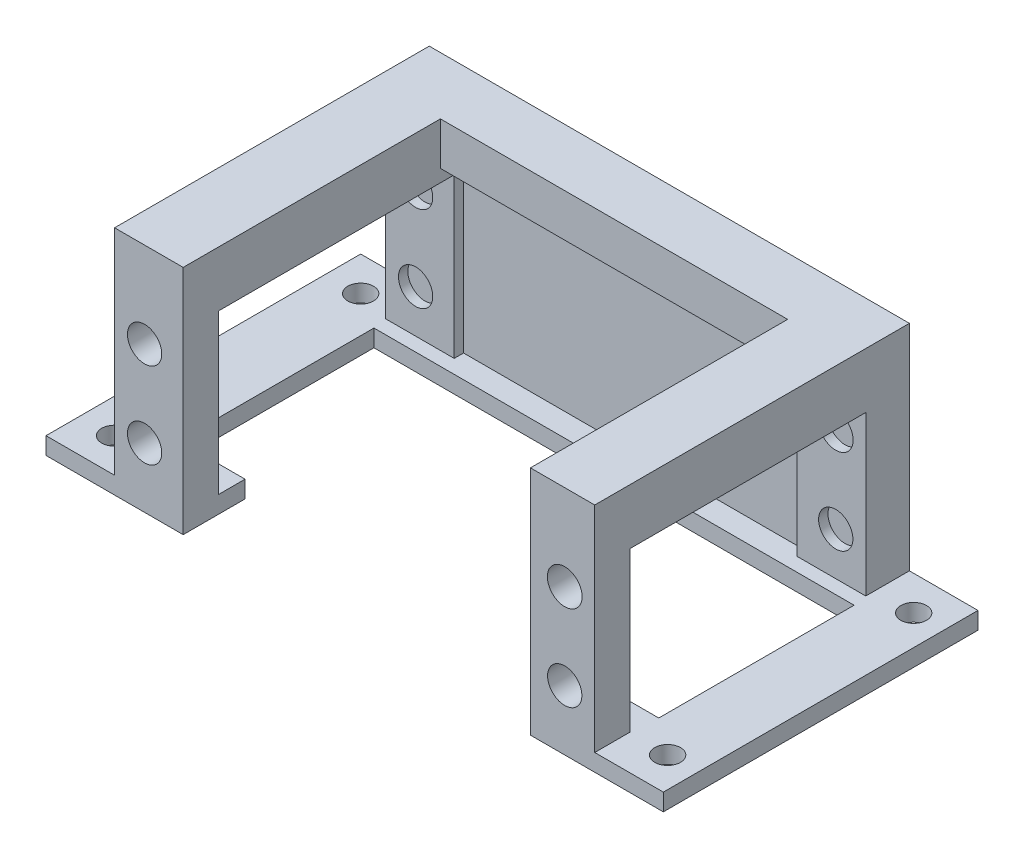
from build123d import *

# Parameters (mm, degrees)
SKETCH_1_W               = 40
SKETCH_1_H               = 40
EXTRUDE_1_DEPTH          = 20
SKETCH_2_R               = 3
EXTRUDE_2_DEPTH          = 4.5
SKETCH_4_R               = 2
SKETCH_4_W               = 8
SKETCH_4_H               = 20
EXTRUDE_4_DEPTH          = 2.7
SKETCH_5_W               = 4
SKETCH_5_H               = 7
EXTRUDE_5_DEPTH          = 7
SKETCH_6_W               = 48
SKETCH_6_H               = 20
CUT_EXTRUDE_1_DEPTH      = 27.5
CUT_EXTRUDE_3_DEPTH      = 54.481305145
CUT_EXTRUDE_3_DEPTH_BACK = 54.481305145
SKETCH_7_W               = 40
SKETCH_7_H               = 20
SKETCH_8_W               = 56
SKETCH_8_H               = 5
EXTRUDE_6_DEPTH          = 2.7
SKETCH_9_W               = 56
SKETCH_9_H               = 25
EXTRUDE_7_DEPTH          = 30
CUT_EXTRUDE_4_DEPTH      = 62.878914018
CUT_EXTRUDE_4_DEPTH_BACK = 62.878914018
SKETCH_10_W              = 40
SKETCH_10_H              = 20
CUT_EXTRUDE_5_DEPTH      = 64.232033021
CUT_EXTRUDE_5_DEPTH_BACK = 64.232033021
SKETCH_11_R              = 2
SKETCH_11_R_2            = 2.023853946
CUT_EXTRUDE_6_DEPTH      = 75.500268456
CUT_EXTRUDE_6_DEPTH_BACK = 75.500268456
SKETCH_12_W              = 27.5
SKETCH_12_H              = 18.538560396
SKETCH_13_W              = 56
SKETCH_13_H              = 25
EXTRUDE_8_DEPTH          = 4
SKETCH_14_W              = 36.7
SKETCH_14_H              = 2
EXTRUDE_9_DEPTH          = 56
SKETCH_15_W              = 36.7
SKETCH_15_H              = 2
EXTRUDE_10_DEPTH         = 8
SKETCH_16_W              = 36.7
SKETCH_16_H              = 2
EXTRUDE_11_DEPTH         = 8
CUT_EXTRUDE_7_DEPTH      = 76.918969961
CUT_EXTRUDE_7_DEPTH_BACK = 76.918969961
SKETCH_17_W              = 40.5
SKETCH_17_H              = 30
SKETCH_20_W              = 7.75
SKETCH_20_H              = 22.78217045
CUT_EXTRUDE_9_DEPTH      = 8
SKETCH_21_R              = 1.5
CUT_EXTRUDE_10_DEPTH     = 78.515740337


with BuildPart() as part:
    # 草图1 → 凸台-拉伸1 (new body)
    with BuildSketch(Plane(origin=(0, 0, 0), x_dir=(1, 0, 0), z_dir=(0, 1, 0))):
        with Locations((20, 20)):
            Rectangle(SKETCH_1_W, SKETCH_1_H)
    extrude(amount=EXTRUDE_1_DEPTH)

    # 草图2 → 凸台-拉伸2 (add)
    with BuildSketch(Plane.XY):
        with Locations(Location((10, 10, 0), (0, 0, 180))):
            Circle(SKETCH_2_R)
    extrude(amount=EXTRUDE_2_DEPTH)

    # 草图4 → 凸台-拉伸4 (add)
    # profile 1 of 3: a face of its own
    with BuildSketch(Plane(origin=(0, 0, -12.3), x_dir=(-1, 0, 0), z_dir=(0, 0, -1))):
        with BuildLine():
            Line((-44.5, 17), (-44.5, 20))
            Line((-44.5, 20), (-48, 20))
            Line((-48, 20), (-48, 0))
            Line((-48, 0), (-40, 0))
            Line((-40, 0), (-40, 15))
            Line((-40, 15), (-42.5, 15))
            ThreePointArc((-42.5, 15), (-45.914213562, 13.585786438), (-44.5, 17))
        make_face()
        with Locations((-44.5, 5)):
            Circle(SKETCH_4_R, mode=Mode.SUBTRACT)
    # profile 2 of 3: a face of its own
    with BuildSketch(Plane(origin=(0, 0, -12.3), x_dir=(-1, 0, 0), z_dir=(0, 0, -1))):
        with BuildLine():
            Line((-40, 15), (-40, 20))
            Line((-40, 20), (-44.5, 20))
            Line((-44.5, 20), (-44.5, 17))
            ThreePointArc((-44.5, 17), (-43.085786438, 16.414213562), (-42.5, 15))
            Line((-42.5, 15), (-40, 15))
        make_face()
    # profile 3 of 3: a face of its own
    with BuildSketch(Plane(origin=(0, 0, -12.3), x_dir=(-1, 0, 0), z_dir=(0, 0, -1))):
        with Locations((4, 10)):
            Rectangle(SKETCH_4_W, SKETCH_4_H)
        with Locations((4.5, 5)):
            Circle(SKETCH_4_R, mode=Mode.SUBTRACT)
        with Locations((4.5, 15)):
            Circle(SKETCH_4_R, mode=Mode.SUBTRACT)
    extrude(amount=-EXTRUDE_4_DEPTH)

    # 草图5 → 凸台-拉伸5 (add)
    with BuildSketch(Plane.ZY):
        with Locations((-35, 10)):
            Rectangle(SKETCH_5_W, SKETCH_5_H)
    extrude(amount=EXTRUDE_5_DEPTH)

    # 草图6 → 切除-拉伸1 (cut)
    with BuildSketch(Plane(origin=(0, 0, -40), x_dir=(-1, 0, 0), z_dir=(0, 0, -1))):
        with Locations((-16, 10)):
            Rectangle(SKETCH_6_W, SKETCH_6_H)
    extrude(amount=-CUT_EXTRUDE_1_DEPTH, mode=Mode.SUBTRACT)

    # 草图7 → 切除-拉伸3 (cut, two sides: drawn at the far end of the back side and taken through both)
    with BuildSketch(Plane.XY.offset(-CUT_EXTRUDE_3_DEPTH_BACK)):
        with Locations((20, 10)):
            Rectangle(SKETCH_7_W, SKETCH_7_H)
    extrude(amount=CUT_EXTRUDE_3_DEPTH + CUT_EXTRUDE_3_DEPTH_BACK, mode=Mode.SUBTRACT)


with BuildPart() as cut_extrude_3_piece_1:
    # of the separate pieces the step leaves, piece 1, a body of its own (cut_extrude_3_pieces)
    add(part.part.solids().sort_by_distance((0, 20, -9.6))[0])



with BuildPart() as cut_extrude_3_piece_2:
    # of the separate pieces the step leaves, piece 2, a body of its own (cut_extrude_3_pieces)
    add(part.part.solids().sort_by_distance((40, 0, -9.6))[0])


with BuildPart() as cut_extrude_3_piece_1_1:
    add(cut_extrude_3_piece_1.part)

    add(cut_extrude_3_piece_2.part)  # 凸台-拉伸6 merges 切除-拉伸3 piece 2
    # 草图8 → 凸台-拉伸6 (add)
    with BuildSketch(Plane.XY.offset(-9.6)):
        with Locations((20, 22.5)):
            Rectangle(SKETCH_8_W, SKETCH_8_H)
    extrude(amount=-EXTRUDE_6_DEPTH)

    # 草图9 → 凸台-拉伸7 (add)
    with BuildSketch(Plane(origin=(0, 0, -12.3), x_dir=(-1, 0, 0), z_dir=(0, 0, -1))):
        with Locations((-20, 12.5)):
            Rectangle(SKETCH_9_W, SKETCH_9_H)
    extrude(amount=EXTRUDE_7_DEPTH)

    # 草图10 → 切除-拉伸4 (cut, two sides: drawn at the far end of the back side and taken through both)
    with BuildSketch(Plane.XY.offset(-12.3).offset(-CUT_EXTRUDE_4_DEPTH_BACK)):
        with Locations((20, 10)):
            Rectangle(SKETCH_10_W, SKETCH_10_H)
    extrude(amount=CUT_EXTRUDE_4_DEPTH + CUT_EXTRUDE_4_DEPTH_BACK, mode=Mode.SUBTRACT)

    # 草图11 → 切除-拉伸5 (cut, two sides: drawn at the far end of the back side and taken through both)
    with BuildSketch(Plane.XY.offset(-9.6).offset(-CUT_EXTRUDE_5_DEPTH_BACK)):
        with Locations(Location((-4.5, 15, 0), (0, 0, 180))):
            Circle(SKETCH_11_R)
        with Locations(Location((-4.5, 5, 0), (0, 0, 180))):
            Circle(SKETCH_11_R)
        with Locations((44.5, 15)):
            Circle(SKETCH_11_R_2)
        with Locations(Location((44.5, 5, 0), (0, 0, 180))):
            Circle(SKETCH_11_R)
    extrude(amount=CUT_EXTRUDE_5_DEPTH + CUT_EXTRUDE_5_DEPTH_BACK, mode=Mode.SUBTRACT)

    # 草图12 → 切除-拉伸6 (cut, two sides: drawn at the far end of the back side and taken through both)
    with BuildSketch(Plane(origin=(48, 0, 0), x_dir=(0, 0, -1), z_dir=(1, 0, 0)).offset(-CUT_EXTRUDE_6_DEPTH_BACK)):
        with Locations((27.459022476, 9.269280198)):
            Rectangle(SKETCH_12_W, SKETCH_12_H)
    extrude(amount=CUT_EXTRUDE_6_DEPTH + CUT_EXTRUDE_6_DEPTH_BACK, mode=Mode.SUBTRACT)

    # 草图13 → 凸台-拉伸8 (add)
    with BuildSketch(Plane(origin=(0, 0, -42.3), x_dir=(-1, 0, 0), z_dir=(0, 0, -1))):
        with Locations((-20, 12.5)):
            Rectangle(SKETCH_13_W, SKETCH_13_H)
    extrude(amount=EXTRUDE_8_DEPTH)

    # 草图14 → 凸台-拉伸9 (add)
    with BuildSketch(Plane(origin=(48, 0, 0), x_dir=(0, 0, -1), z_dir=(1, 0, 0))):
        with Locations((27.95, -1)):
            Rectangle(SKETCH_14_W, SKETCH_14_H)
    extrude(amount=-EXTRUDE_9_DEPTH)

    # 草图15 → 凸台-拉伸10 (add)
    with BuildSketch(Plane(origin=(48, 0, 0), x_dir=(0, 0, -1), z_dir=(1, 0, 0))):
        with Locations((27.95, -1)):
            Rectangle(SKETCH_15_W, SKETCH_15_H)
    extrude(amount=EXTRUDE_10_DEPTH)

    # 草图16 → 凸台-拉伸11 (add)
    with BuildSketch(Plane.ZY.offset(8)):
        with Locations((-27.95, -1)):
            Rectangle(SKETCH_16_W, SKETCH_16_H)
    extrude(amount=EXTRUDE_11_DEPTH)

    # 草图17 → 切除-拉伸7 (cut, two sides: drawn at the far end of the back side and taken through both)
    with BuildSketch(Plane.XZ.offset(-20).offset(-CUT_EXTRUDE_7_DEPTH_BACK)):
        with Locations((20.25, -24.6)):
            Rectangle(SKETCH_17_W, SKETCH_17_H)
    extrude(amount=CUT_EXTRUDE_7_DEPTH + CUT_EXTRUDE_7_DEPTH_BACK, mode=Mode.SUBTRACT)

    # 草图20 → 切除-拉伸9 (cut)
    with BuildSketch(Plane.XZ.offset(2)):
        with Locations((-3.875, -28.208914775)):
            Rectangle(SKETCH_20_W, SKETCH_20_H)
        with Locations((44.375, -28.208914775)):
            Rectangle(SKETCH_20_W, SKETCH_20_H)
    extrude(amount=-CUT_EXTRUDE_9_DEPTH, mode=Mode.SUBTRACT)

    # 草图21 → 切除-拉伸10 (cut, through all)
    with BuildSketch(Plane.XZ.offset(2)):
        with Locations(Location((52.5, -42.3, 0), (0, 0, 270))):
            Circle(SKETCH_21_R)
        with Locations(Location((52.5, -13.6, 0), (0, 0, 270))):
            Circle(SKETCH_21_R)
        with Locations(Location((-12, -13.6, 0), (0, 0, 270))):
            Circle(SKETCH_21_R)
        with Locations(Location((-12, -42.3, 0), (0, 0, 270))):
            Circle(SKETCH_21_R)
    extrude(amount=-CUT_EXTRUDE_10_DEPTH, mode=Mode.SUBTRACT)


solid = cut_extrude_3_piece_1_1.part
